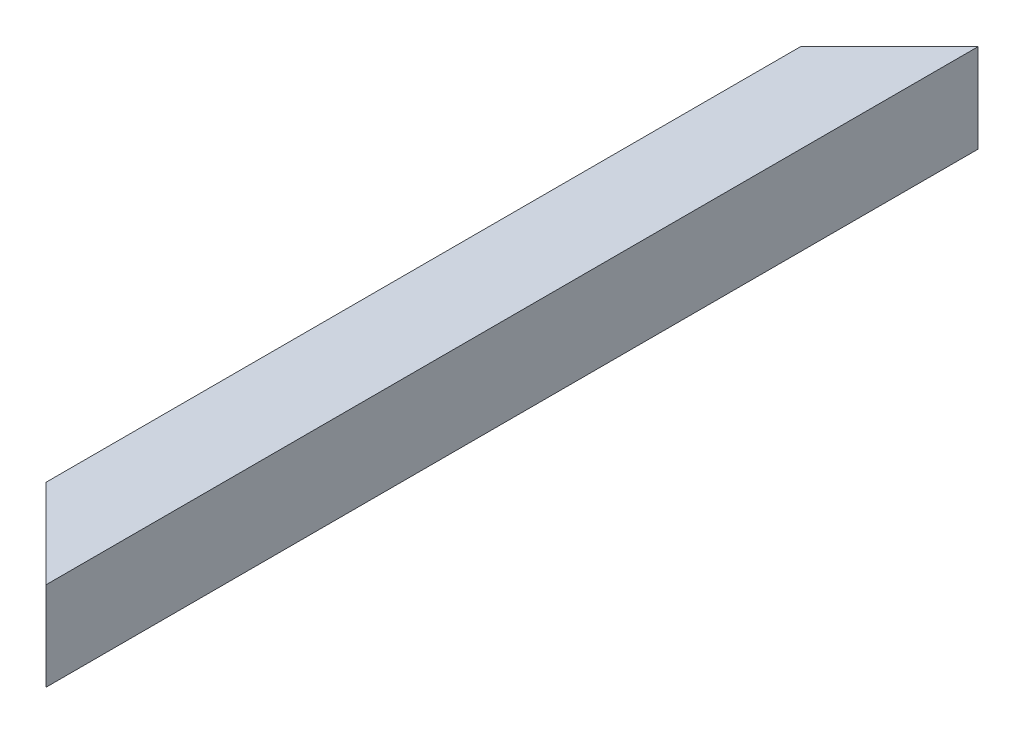
from build123d import *

# Parameters (mm, degrees)
SKETCH3_W               = 19.05
SKETCH3_H               = 19.05
BOSS_EXTRUDE1_DEPTH     = 100
SKETCH5_W               = 16.65
SKETCH5_H               = 16.65
CUT_EXTRUDE1_DEPTH      = 201.453114842
CUT_EXTRUDE2_DEPTH      = 101.903177601
CUT_EXTRUDE2_DEPTH_BACK = 101.903177601


with BuildPart() as part:
    # Sketch3 → Boss-Extrude1 (new, symmetric)
    with BuildSketch(Plane.XY):
        Rectangle(SKETCH3_W, SKETCH3_H)
    extrude(amount=BOSS_EXTRUDE1_DEPTH, both=True)

    # Sketch5 → Cut-Extrude1 (cut, through all)
    with BuildSketch(Plane(origin=(0, 0, -100), x_dir=(-1, 0, 0), z_dir=(0, 0, -1))):
        Rectangle(SKETCH5_W, SKETCH5_H)
    extrude(amount=-CUT_EXTRUDE1_DEPTH, mode=Mode.SUBTRACT)

    # Sketch7 → Cut-Extrude2 (cut, two sides: drawn at the far end of the back side and taken through both)
    with BuildSketch(Plane(origin=(0, 0, 0), x_dir=(1, 0, 0), z_dir=(0, 1, 0)).offset(-CUT_EXTRUDE2_DEPTH_BACK)):
        Polygon((9.525, 100), (-9.525, 100), (-9.525, 80.95), align=None)
        Polygon((-9.525, -80.95), (9.525, -100), (-9.525, -100), align=None)
    extrude(amount=CUT_EXTRUDE2_DEPTH + CUT_EXTRUDE2_DEPTH_BACK, mode=Mode.SUBTRACT)


solid = part.part
